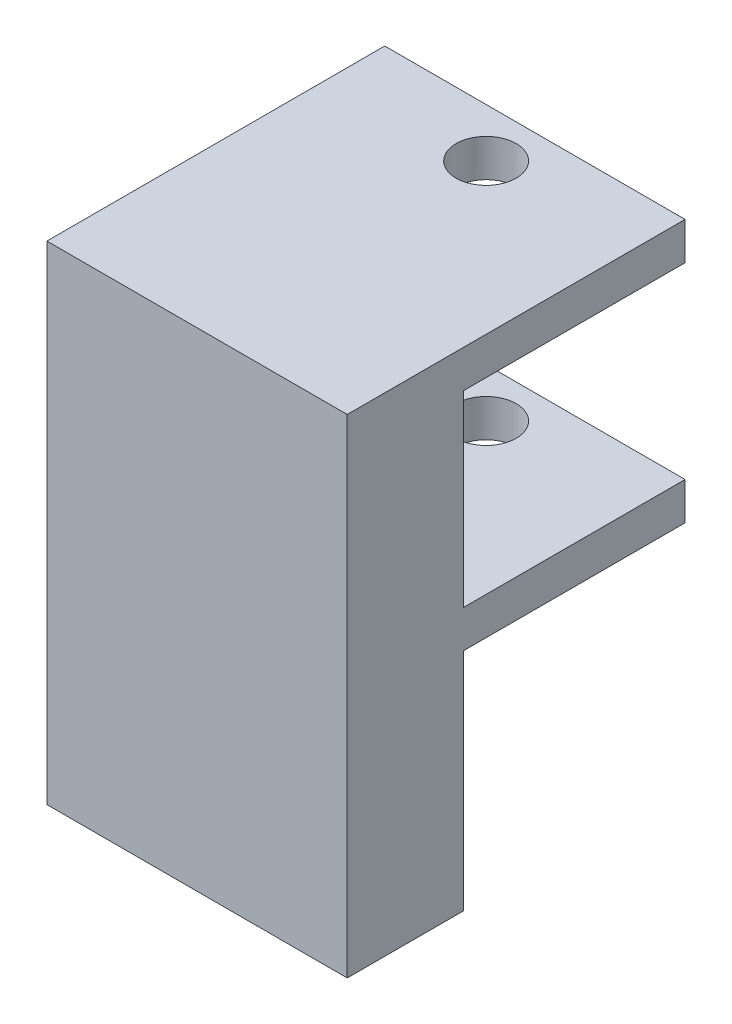
from build123d import *

# Parameters (mm, degrees)
ESBO_O1_W                = 40
ESBO_O1_H                = 15.5
RESSALTO_EXTRUS_O1_DEPTH = 30
ESBO_O2_W                = 7
ESBO_O2_H                = 7
CORTE_EXTRUS_O1_DEPTH    = 12
ESBO_O5_W                = 40
ESBO_O5_H                = 45
RESSALTO_EXTRUS_O2_DEPTH = 5
ESBO_O6_W                = 40
ESBO_O6_H                = 15.5
RESSALTO_EXTRUS_O3_DEPTH = 25
ESBO_O7_W                = 40
ESBO_O7_H                = 45
RESSALTO_EXTRUS_O4_DEPTH = 5
ESBO_O8_R                = 4
CORTE_EXTRUS_O2_DEPTH    = 89.600225733


with BuildPart() as part:
    # Esboço1 → Ressalto-extrusão1 (new body)
    with BuildSketch(Plane(origin=(0, 0, 0), x_dir=(1, 0, 0), z_dir=(0, 1, 0))):
        with Locations((20, 7.75)):
            Rectangle(ESBO_O1_W, ESBO_O1_H)
    extrude(amount=RESSALTO_EXTRUS_O1_DEPTH)

    # Esboço2 → Corte-extrusão1 (cut)
    with BuildSketch(Plane.XZ):
        with Locations((7.5, -7.5)):
            Rectangle(ESBO_O2_W, ESBO_O2_H)
        with Locations((32.5, -7.5)):
            Rectangle(ESBO_O2_W, ESBO_O2_H)
    extrude(amount=-CORTE_EXTRUS_O1_DEPTH, mode=Mode.SUBTRACT)

    # Esboço5 → Ressalto-extrusão2 (add)
    with BuildSketch(Plane(origin=(0, 30, 0), x_dir=(1, 0, 0), z_dir=(0, 1, 0))):
        with Locations((20, 22.5)):
            Rectangle(ESBO_O5_W, ESBO_O5_H)
    extrude(amount=RESSALTO_EXTRUS_O2_DEPTH)

    # Esboço6 → Ressalto-extrusão3 (add)
    with BuildSketch(Plane(origin=(0, 35, 0), x_dir=(1, 0, 0), z_dir=(0, 1, 0))):
        with Locations((20, 7.75)):
            Rectangle(ESBO_O6_W, ESBO_O6_H)
    extrude(amount=RESSALTO_EXTRUS_O3_DEPTH)

    # Esboço7 → Ressalto-extrusão4 (add)
    with BuildSketch(Plane(origin=(0, 60, 0), x_dir=(1, 0, 0), z_dir=(0, 1, 0))):
        with Locations((20, 22.5)):
            Rectangle(ESBO_O7_W, ESBO_O7_H)
    extrude(amount=RESSALTO_EXTRUS_O4_DEPTH)

    # Esboço8 → Corte-extrusão2 (cut, through all)
    with BuildSketch(Plane(origin=(0, 65, 0), x_dir=(1, 0, 0), z_dir=(0, 1, 0))):
        with Locations(Location((20, 38.5, 0), (0, 0, 270))):
            Circle(ESBO_O8_R)
    extrude(amount=-CORTE_EXTRUS_O2_DEPTH, mode=Mode.SUBTRACT)


solid = part.part
